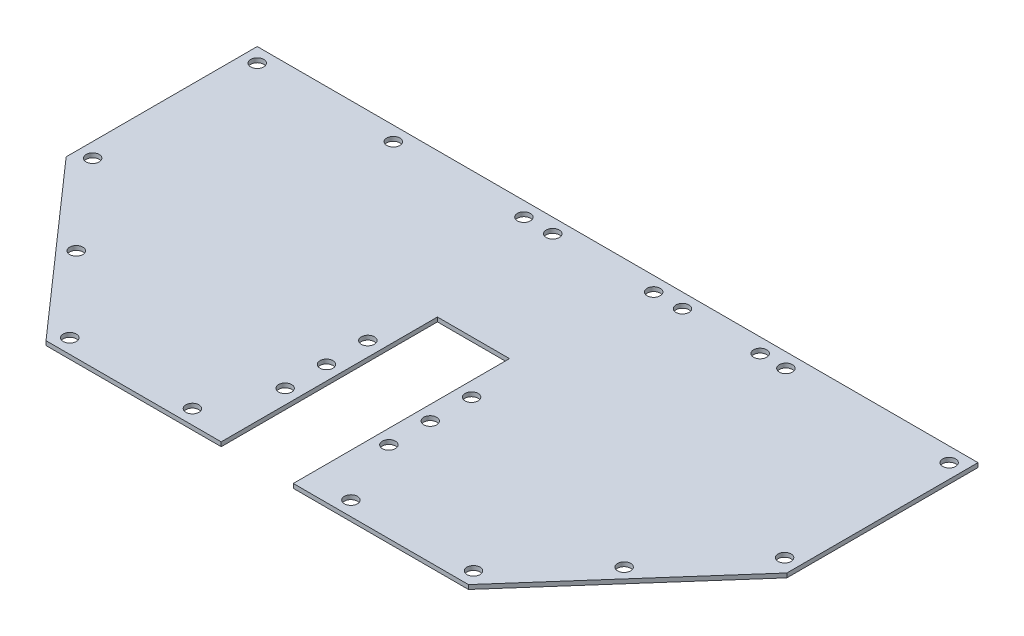
from build123d import *

# Parameters (mm, degrees)
SKETCH1_R           = 2.3
BOSS_EXTRUDE1_DEPTH = 1.5


with BuildPart() as part:
    # Sketch1 → Boss-Extrude1 (new body)
    with BuildSketch(Plane(origin=(0, 0, 0), x_dir=(1, 0, 0), z_dir=(0, 1, 0))):
        Polygon((52.556347973, -126.995854643), (114.3, -126.995854643), (114.3, -50.8), (139.7, -50.8), (139.7, -126.995854643), (201.436197447, -126.995854643), (254, -67.34), (254, 0), (0, 0), (0, -67.34), align=None)
        with Locations(Location((5.08, -5.08, 0), (0, 0, 270))):
            Circle(SKETCH1_R, mode=Mode.SUBTRACT)
        with Locations(Location((53.03, -5.08, 0), (0, 0, 270))):
            Circle(SKETCH1_R, mode=Mode.SUBTRACT)
        with Locations(Location((99.06, -5.08, 0), (0, 0, 270))):
            Circle(SKETCH1_R, mode=Mode.SUBTRACT)
        with Locations(Location((5.08, -63.08, 0), (0, 0, 270))):
            Circle(SKETCH1_R, mode=Mode.SUBTRACT)
        with Locations(Location((99.066197447, -121.915854643, 0), (0, 0, 270))):
            Circle(SKETCH1_R, mode=Mode.SUBTRACT)
        with Locations(Location((55.856197447, -121.915854643, 0), (0, 0, 270))):
            Circle(SKETCH1_R, mode=Mode.SUBTRACT)
        with Locations(Location((182.3, -5.08, 0), (0, 0, 270))):
            Circle(SKETCH1_R, mode=Mode.SUBTRACT)
        with Locations(Location((248.919999642, -5.086414302, 0), (0, 0, 270))):
            Circle(SKETCH1_R, mode=Mode.SUBTRACT)
        with Locations(Location((248.92, -63.086414302, 0), (0, 0, 270))):
            Circle(SKETCH1_R, mode=Mode.SUBTRACT)
        with Locations(Location((198.136197447, -121.915854643, 0), (0, 0, 270))):
            Circle(SKETCH1_R, mode=Mode.SUBTRACT)
        with Locations(Location((154.926197447, -121.915854643, 0), (0, 0, 270))):
            Circle(SKETCH1_R, mode=Mode.SUBTRACT)
        with Locations(Location((144.78, -5.08, 0), (0, 0, 270))):
            Circle(SKETCH1_R, mode=Mode.SUBTRACT)
        with Locations(Location((109.22, -5.08, 0), (0, 0, 270))):
            Circle(SKETCH1_R, mode=Mode.SUBTRACT)
        with Locations(Location((154.94, -5.08, 0), (0, 0, 270))):
            Circle(SKETCH1_R, mode=Mode.SUBTRACT)
        with Locations(Location((191.38, -5.08, 0), (0, 0, 270))):
            Circle(SKETCH1_R, mode=Mode.SUBTRACT)
        with Locations(Location((223.528114705, -94.239074881, 0), (0, 0, 270))):
            Circle(SKETCH1_R, mode=Mode.SUBTRACT)
        with Locations(Location((144.78, -98.385854643, 0), (0, 0, 270))):
            Circle(SKETCH1_R, mode=Mode.SUBTRACT)
        with Locations(Location((144.78, -83.815854643, 0), (0, 0, 270))):
            Circle(SKETCH1_R, mode=Mode.SUBTRACT)
        with Locations(Location((144.78, -69.245854643, 0), (0, 0, 270))):
            Circle(SKETCH1_R, mode=Mode.SUBTRACT)
        with Locations(Location((109.22, -70.245854643, 0), (0, 0, 270))):
            Circle(SKETCH1_R, mode=Mode.SUBTRACT)
        with Locations(Location((109.22, -84.815854643, 0), (0, 0, 270))):
            Circle(SKETCH1_R, mode=Mode.SUBTRACT)
        with Locations(Location((109.22, -99.385854643, 0), (0, 0, 270))):
            Circle(SKETCH1_R, mode=Mode.SUBTRACT)
        with Locations(Location((30.466395088, -94.237134728, 0), (0, 0, 270))):
            Circle(SKETCH1_R, mode=Mode.SUBTRACT)
    extrude(amount=BOSS_EXTRUDE1_DEPTH)


solid = part.part
